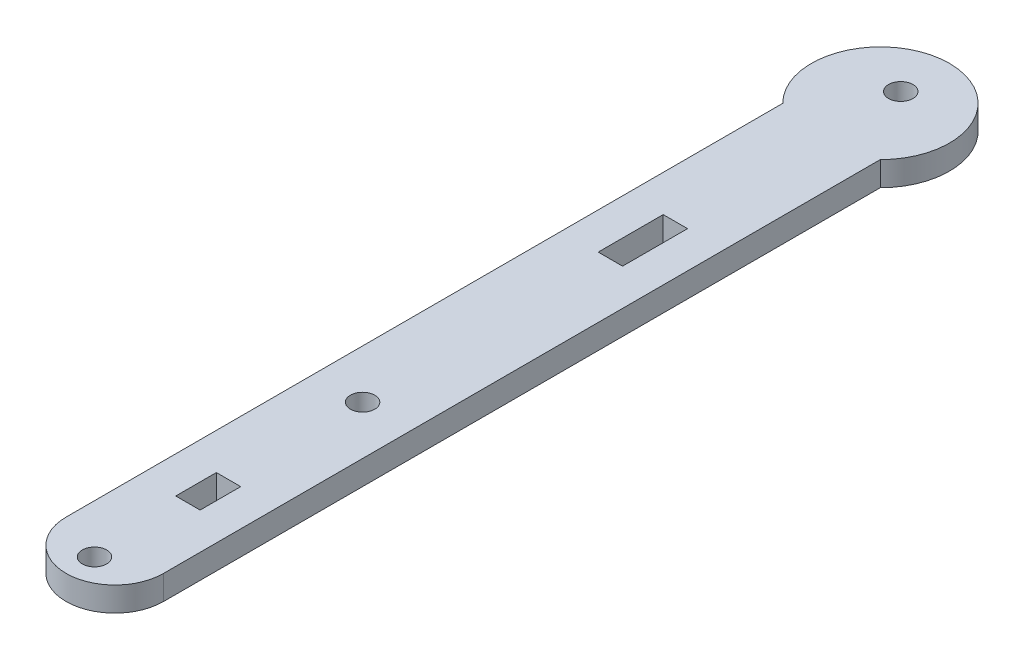
from build123d import *

# Parameters (mm, degrees)
CROQUIS1_R                 = 1.5
CROQUIS1_W                 = 3
CROQUIS1_H                 = 7.999999999
CROQUIS1_H_2               = 5
SALIENTE_EXTRUIR1_DEPTH    = 3
S_LIDO_MOVER_COPIAR1_ANGLE = 90


with BuildPart() as part:
    # Croquis1 → Saliente-Extruir1 (new body)
    with BuildSketch(Plane.XY):
        with BuildLine():
            Line((41807.173257962, -434.43949549), (41807.173257962, -346.219921492))
            ThreePointArc((41807.173257962, -346.219921492), (41801.173257962, -331.699124202), (41795.173257962, -346.219921492))
            Line((41795.173257962, -346.219921492), (41795.173257962, -434.43949549))
            ThreePointArc((41795.173257962, -434.43949549), (41801.173257962, -440.43949549), (41807.173257962, -434.43949549))
        make_face()
        with Locations((41801.173257962, -337.699124202)):
            Circle(CROQUIS1_R, mode=Mode.SUBTRACT)
        with Locations((41801.173257962, -403.93949549)):
            Circle(CROQUIS1_R, mode=Mode.SUBTRACT)
        with Locations((41801.173257962, -436.93949549)):
            Circle(CROQUIS1_R, mode=Mode.SUBTRACT)
        with Locations((41801.173257962, -369.439495491)):
            Rectangle(CROQUIS1_W, CROQUIS1_H, mode=Mode.SUBTRACT)
        with Locations((41801.173257962, -422.93949549)):
            Rectangle(CROQUIS1_W, CROQUIS1_H_2, mode=Mode.SUBTRACT)
    extrude(amount=SALIENTE_EXTRUIR1_DEPTH)


with BuildPart() as part_1:
    # Sólido-Mover/Copiar1: moved
    add(part.part.rotate(Axis((0, -386.069309846, 1.5), (-1, 0, 0)), S_LIDO_MOVER_COPIAR1_ANGLE))


solid = part_1.part
